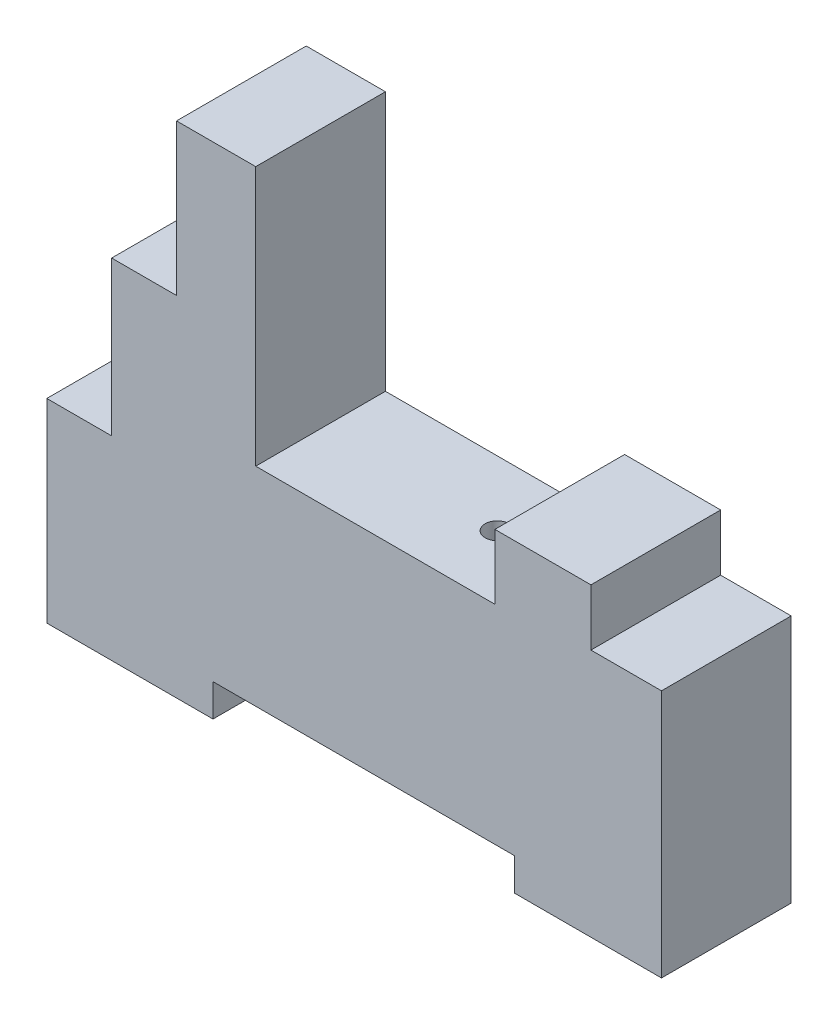
from build123d import *

# Parameters (mm, degrees)
BOSS_EXTRUDE1_DEPTH = 16
SKETCH2_R           = 1.5
CUT_EXTRUDE1_DEPTH  = 84.837177911


with BuildPart() as part:
    # Sketch1 → Boss-Extrude1 (new body)
    with BuildSketch(Plane.XY):
        Polygon((0, 0), (0, 24), (8, 24), (8, 43), (16, 43), (16, 61.65), (25.77, 61.65), (25.77, 29.65), (55.27, 29.65), (55.27, 37.65), (67.12, 37.65), (67.12, 30.68), (75.82, 30.68), (75.82, 0), (57.7, 0), (57.7, 4), (20.5, 4), (20.5, 0), align=None)
    extrude(amount=BOSS_EXTRUDE1_DEPTH)

    # Sketch2 → Cut-Extrude1 (cut, through all)
    with BuildSketch(Plane(origin=(0, 29.65, 0), x_dir=(1, 0, 0), z_dir=(0, 1, 0))):
        with Locations(Location((47.57, -8, 0), (0, 0, 270))):
            Circle(SKETCH2_R)
    extrude(amount=-CUT_EXTRUDE1_DEPTH, mode=Mode.SUBTRACT)


solid = part.part
